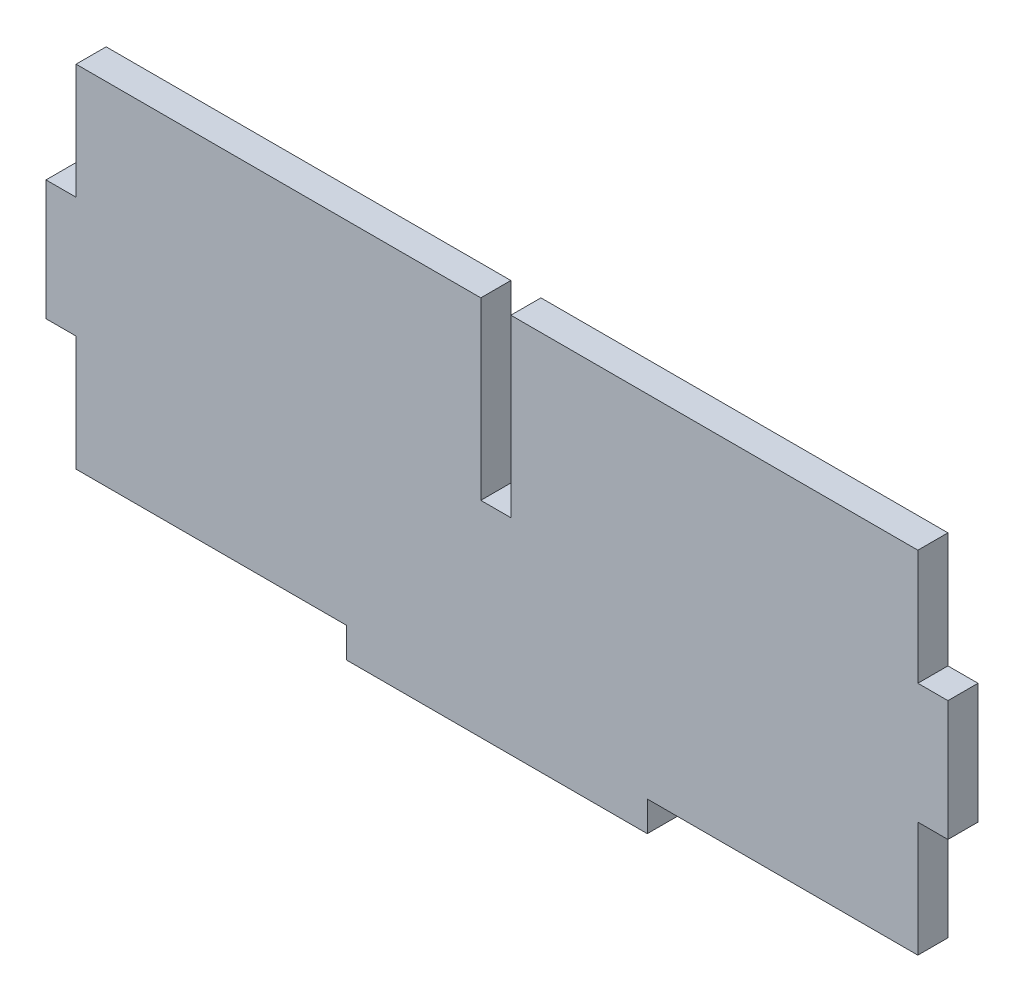
from build123d import *

# Parameters (mm, degrees)
BOSS_EXTRUDE1_DEPTH = 3


with BuildPart() as part:
    # Sketch1 → Boss-Extrude1 (new body)
    with BuildSketch(Plane.XY):
        Polygon((-42, -4.5), (-42, -16), (-15, -16), (-15, -19), (15, -19), (15, -16), (42, -16), (42, -4.5), (45, -4.5), (45, 7.5), (42, 7.5), (42, 19), (1.387020545, 19), (1.387020545, 1.5), (-1.612979455, 1.5), (-1.612979455, 19), (-42, 19), (-42, 7.5), (-45, 7.5), (-45, -4.5), align=None)
    extrude(amount=BOSS_EXTRUDE1_DEPTH)


solid = part.part
